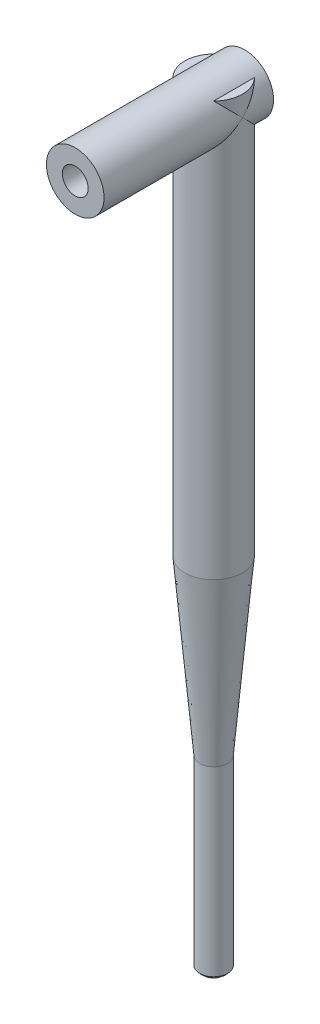
from build123d import *

# Parameters (mm, degrees)
BOSS_EXTRUDE1_DEPTH      = 31.22
BOSS_EXTRUDE1_DEPTH_BACK = 7
SKETCH2_R                = 6.5
SKETCH3_R                = 2.918906714
CUT_EXTRUDE1_DEPTH       = 8.36


with BuildPart() as part:
    # Sketch1 → Revolve1 (revolve)
    with BuildSketch(Plane(origin=(0, 0, 0), x_dir=(0, 0, -1), z_dir=(1, 0, 0))):
        with BuildLine():
            Line((0, 4.6), (0, -170.4))
            ThreePointArc((0, -170.4), (-1.759110094, -169.980737232), (-3.14, -168.813093167))
            Line((-3.14, -168.813093167), (-3.14, -127.813093167))
            Line((-3.14, -127.813093167), (-6.5, -88.9))
            Line((-6.5, -88.9), (-6.5, 4.6))
            Line((-6.5, 4.6), (0, 4.6))
        make_face()
    revolve(axis=Axis((0, 4.6, 0), (0, -1, 0)))

    # Sketch2 → Boss-Extrude1 (add, two sides: drawn at the far end of the back side and taken through both)
    with BuildSketch(Plane.XY.offset(-BOSS_EXTRUDE1_DEPTH_BACK)):
        Circle(SKETCH2_R)
    extrude(amount=BOSS_EXTRUDE1_DEPTH + BOSS_EXTRUDE1_DEPTH_BACK)

    # Sketch3 → Cut-Extrude1 (cut)
    with BuildSketch(Plane.XY.offset(31.22)):
        Circle(SKETCH3_R)
    extrude(amount=-CUT_EXTRUDE1_DEPTH, mode=Mode.SUBTRACT)


solid = part.part
